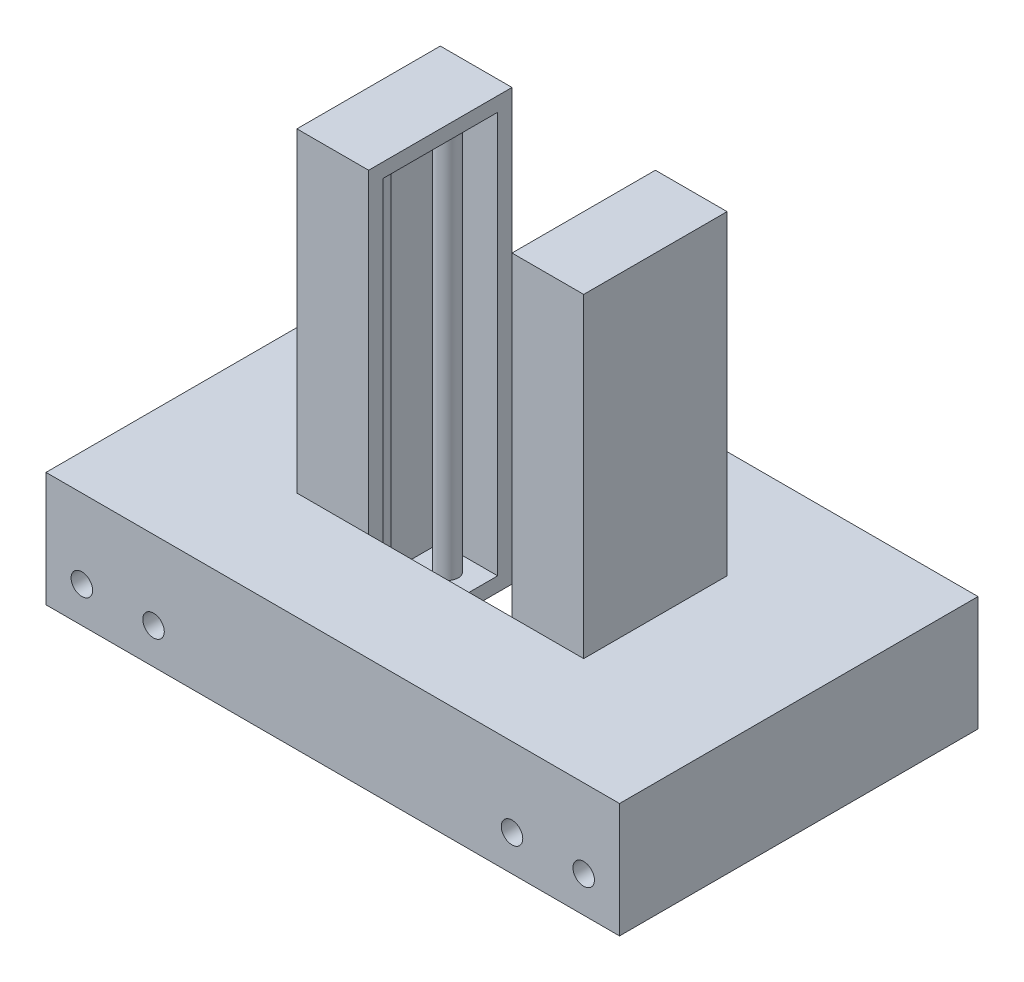
from build123d import *

# Parameters (mm, degrees)
SKETCH1_W           = 400
SKETCH1_H           = 250
BOSS_EXTRUDE1_DEPTH = 80
SKETCH2_R           = 7.5
CUT_EXTRUDE1_DEPTH  = 479.434948556
SKETCH5_W           = 200
SKETCH5_H           = 100
CUT_EXTRUDE2_DEPTH  = 479.434948556
SKETCH8_W           = 100
SKETCH8_H           = 300
BOSS_EXTRUDE2_DEPTH = 50
SKETCH9_W           = 80
SKETCH9_H           = 280
CUT_EXTRUDE3_DEPTH  = 40
SKETCH10_R          = 7.5
BOSS_EXTRUDE3_DEPTH = 280


with BuildPart() as part:
    # Sketch1 → Boss-Extrude1 (new body)
    with BuildSketch(Plane(origin=(0, 0, 0), x_dir=(1, 0, 0), z_dir=(0, 1, 0))):
        with Locations((-200, 125)):
            Rectangle(SKETCH1_W, SKETCH1_H)
    extrude(amount=BOSS_EXTRUDE1_DEPTH)

    # Sketch2 → Cut-Extrude1 (cut, through all)
    with BuildSketch(Plane.XY):
        with Locations((-375, 25)):
            Circle(SKETCH2_R)
        with Locations((-325, 25)):
            Circle(SKETCH2_R)
        with Locations((-75, 25)):
            Circle(SKETCH2_R)
        with Locations((-25, 25)):
            Circle(SKETCH2_R)
    extrude(amount=-CUT_EXTRUDE1_DEPTH, mode=Mode.SUBTRACT)

    # Sketch5 → Cut-Extrude2 (cut, through all)
    with BuildSketch(Plane(origin=(0, 80, 0), x_dir=(1, 0, 0), z_dir=(0, 1, 0))):
        with Locations((-200, 125)):
            Rectangle(SKETCH5_W, SKETCH5_H)
    extrude(amount=-CUT_EXTRUDE2_DEPTH, mode=Mode.SUBTRACT)

    # Sketch8 → Boss-Extrude2 (add)
    with BuildSketch(Plane(origin=(-300, 0, 0), x_dir=(0, 0, -1), z_dir=(1, 0, 0))):
        with Locations((125, 150)):
            Rectangle(SKETCH8_W, SKETCH8_H)
    boss_extrude2 = extrude(amount=BOSS_EXTRUDE2_DEPTH)

    # Sketch9 → Cut-Extrude3 (cut)
    with BuildSketch(Plane(origin=(-250, 0, 0), x_dir=(0, 0, -1), z_dir=(1, 0, 0))):
        with Locations((125, 150)):
            Rectangle(SKETCH9_W, SKETCH9_H)
    cut_extrude3 = extrude(amount=-CUT_EXTRUDE3_DEPTH, mode=Mode.SUBTRACT)

    # Mirror1: Boss-Extrude2, Cut-Extrude3 across plane
    add(boss_extrude2.mirror(Plane.ZY.offset(200)))
    add(cut_extrude3.mirror(Plane.ZY.offset(200)), mode=Mode.SUBTRACT)

    # Sketch10 → Boss-Extrude3 (add)
    with BuildSketch(Plane(origin=(0, 10, 0), x_dir=(1, 0, 0), z_dir=(0, 1, 0))):
        with Locations(Location((-270, 150, 0), (0, 0, 90))):
            Circle(SKETCH10_R)
        with Locations(Location((-270, 100, 0), (0, 0, 90))):
            Circle(SKETCH10_R)
    boss_extrude3 = extrude(amount=BOSS_EXTRUDE3_DEPTH)

    # Mirror2: Boss-Extrude3 across plane
    add(boss_extrude3.mirror(Plane.ZY.offset(200)))


solid = part.part
